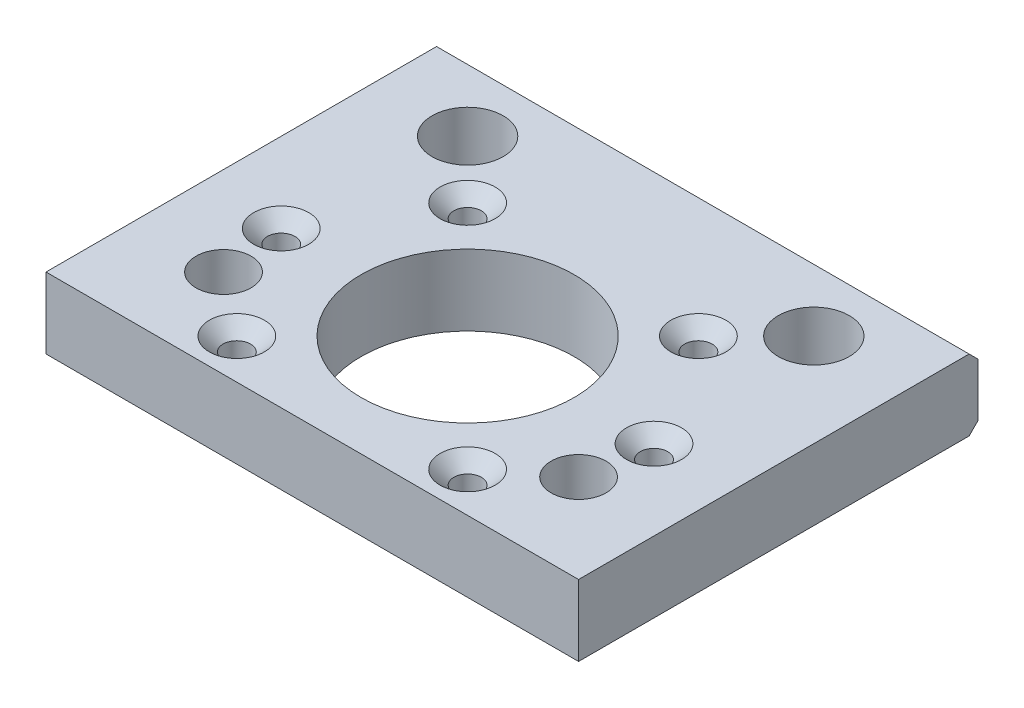
from build123d import *

# Parameters (mm, degrees)
SKETCH_1_W                  = 60
SKETCH_1_H                  = 45
SKETCH_1_R                  = 2.5
SKETCH_1_R_2                = 12
EXTRUDE_1_DEPTH             = 8
CHAMFER_1_SIZE              = 1
SKETCH_2_R                  = 4
CUT_EXTRUDE_1_DEPTH         = 6
SKETCH_3_R                  = 1.25
SKETCH_3_R_2                = 1.55
CUT_EXTRUDE_2_DEPTH         = 39.34383914
HOLE_WIZARD_2_D             = 6.2
HOLE_WIZARD_2_CSINK_D       = 13.2
HOLE_WIZARD_2_CSINK_ANGLE   = 90
HOLE_WIZARD_2_2_D           = 3.1
HOLE_WIZARD_2_2_CSINK_D     = 6.2
HOLE_WIZARD_2_2_CSINK_ANGLE = 90


with BuildPart() as part:
    # 草图1 → 凸台-拉伸1 (new body)
    with BuildSketch(Plane(origin=(0, 0, 0), x_dir=(1, 0, 0), z_dir=(0, 1, 0))):
        Rectangle(SKETCH_1_W, SKETCH_1_H)
        with Locations(Location((-20, -12.5, 0), (0, 0, 270))):
            Circle(SKETCH_1_R, mode=Mode.SUBTRACT)
        with Locations(Location((20, -12.5, 0), (0, 0, 90))):
            Circle(SKETCH_1_R, mode=Mode.SUBTRACT)
        with Locations(Location((0, -5, 0), (0, 0, 270))):
            Circle(SKETCH_1_R_2, mode=Mode.SUBTRACT)
    extrude(amount=EXTRUDE_1_DEPTH)

    # 倒角1
    chamfer_1_edges = [part.edges().sort_by_distance(p)[0] for p in [
        (0, 8, -22.5),
        (0, 0, -22.5),
    ]]
    chamfer(chamfer_1_edges, length=CHAMFER_1_SIZE)

    # 草图2 → 切除-拉伸1 (cut)
    with BuildSketch(Plane(origin=(0, 8, 0), x_dir=(1, 0, 0), z_dir=(0, 1, 0))):
        with Locations(Location((-19.5, 14.5, 0), (0, 0, 270))):
            Circle(SKETCH_2_R)
        with Locations(Location((19.5, 14.5, 0), (0, 0, 90))):
            Circle(SKETCH_2_R)
    extrude(amount=-CUT_EXTRUDE_1_DEPTH, mode=Mode.SUBTRACT)

    # 草图3 → 切除-拉伸2 (cut, through all)
    with BuildSketch(Plane(origin=(0, 0, 0), x_dir=(-1, 0, 0), z_dir=(0, -1, 0))):
        with Locations(Location((13, -18, 0), (0, 0, 90))):
            Circle(SKETCH_3_R)
        with Locations(Location((-13, -18, 0), (0, 0, 270))):
            Circle(SKETCH_3_R)
        with Locations(Location((13, 8, 0), (0, 0, 90))):
            Circle(SKETCH_3_R)
        with Locations(Location((-13, 8, 0), (0, 0, 270))):
            Circle(SKETCH_3_R)
        with Locations(Location((21, -5, 0), (0, 0, 90))):
            Circle(SKETCH_3_R_2)
        with Locations(Location((-21, -5, 0), (0, 0, 90))):
            Circle(SKETCH_3_R_2)
    extrude(amount=-CUT_EXTRUDE_2_DEPTH, mode=Mode.SUBTRACT)

    # Hole Wizard 2 (through all)
    with Locations(Plane(origin=(20, 0, 12.5), x_dir=(0, 0, -1), z_dir=(0, -1, 0))):
        with Locations((0, 0), (0, -40)):
            CounterSinkHole(HOLE_WIZARD_2_D / 2, HOLE_WIZARD_2_CSINK_D / 2, counter_sink_angle=HOLE_WIZARD_2_CSINK_ANGLE)

    # Hole Wizard 2 2 (through all)
    with Locations(Plane(origin=(-13, 8, -8), x_dir=(0, 0, 1), z_dir=(0, 1, 0))):
        with Locations((0, 0), (26, 0), (26, 26), (0, 26), (13, -8), (13, 34)):
            CounterSinkHole(HOLE_WIZARD_2_2_D / 2, HOLE_WIZARD_2_2_CSINK_D / 2, counter_sink_angle=HOLE_WIZARD_2_2_CSINK_ANGLE)


solid = part.part
